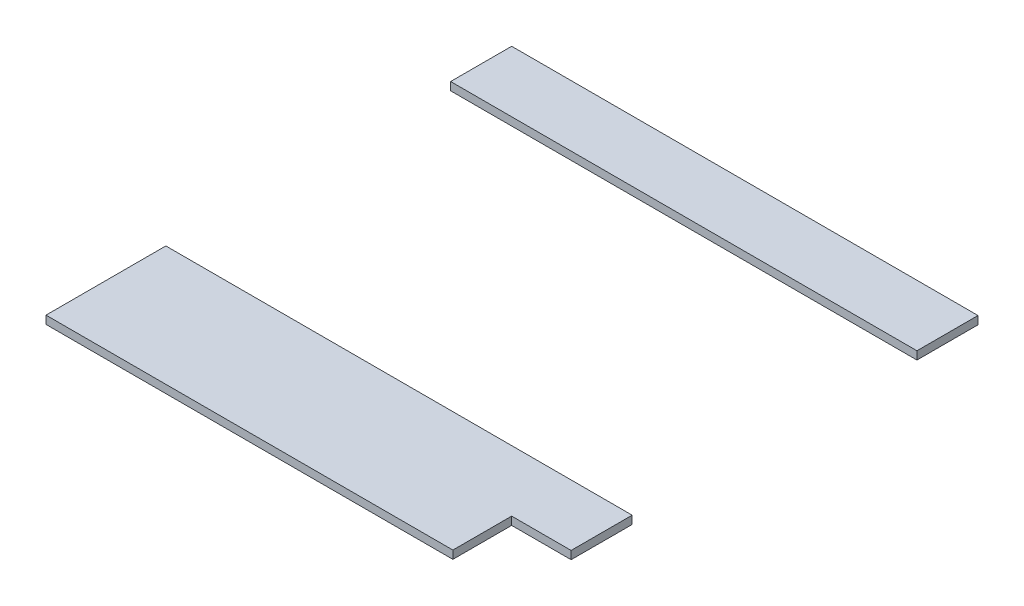
from build123d import *

# Parameters (mm, degrees)
BOSS_EXTRUDE1_DEPTH   = 3.2
SKETCH1_W             = 184.839561026
SKETCH1_H             = 24.2
BOSS_EXTRUDE1_2_DEPTH = 3.2


with BuildPart() as part:
    # Sketch1 → Boss-Extrude1 (new body)
    with BuildSketch(Plane(origin=(0, 0, 0), x_dir=(1, 0, 0), z_dir=(0, 1, 0))):
        Polygon((-80.639561026, -56.439561026), (104.2, -56.439561026), (104.2, -80.639561026), (80.639561026, -80.639561026), (80.639561026, -103.939561026), (-80.639561026, -103.939561026), align=None)
    extrude(amount=-BOSS_EXTRUDE1_DEPTH)


with BuildPart() as body_2:
    # Sketch1 → Boss-Extrude1 2 (new body)
    with BuildSketch(Plane(origin=(0, 0, 0), x_dir=(1, 0, 0), z_dir=(0, 1, 0))):
        with Locations((11.780219487, 68.539561026)):
            Rectangle(SKETCH1_W, SKETCH1_H)
    extrude(amount=-BOSS_EXTRUDE1_2_DEPTH)


solid = Compound([part.part, body_2.part])
